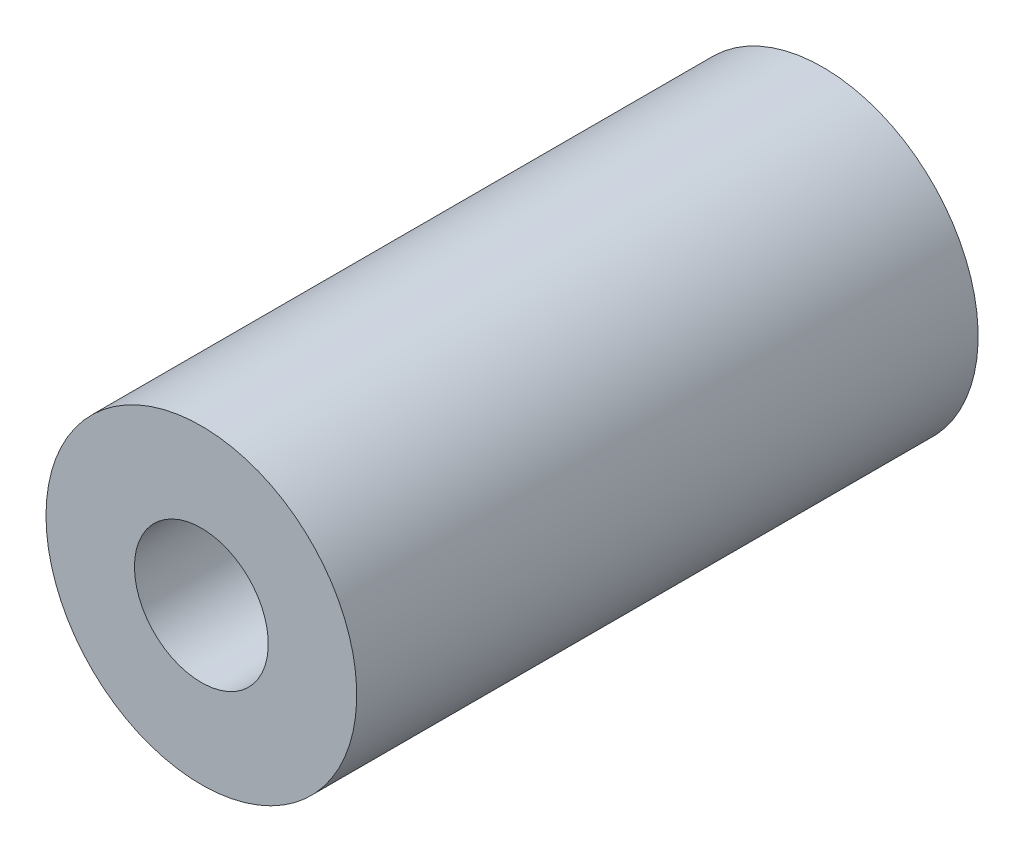
from build123d import *

# Parameters (mm, degrees)
SKETCH1_R           = 9.525
SKETCH1_R_2         = 4.1021
BOSS_EXTRUDE1_DEPTH = 19.05


with BuildPart() as part:
    # Sketch1 → Boss-Extrude1 (new, symmetric)
    with BuildSketch(Plane.XY):
        with Locations(Location((0, 0, 0), (0, 0, 180))):
            Circle(SKETCH1_R)
        with Locations(Location((0, 0, 0), (0, 0, 180))):
            Circle(SKETCH1_R_2, mode=Mode.SUBTRACT)
    extrude(amount=BOSS_EXTRUDE1_DEPTH, both=True)


solid = part.part
